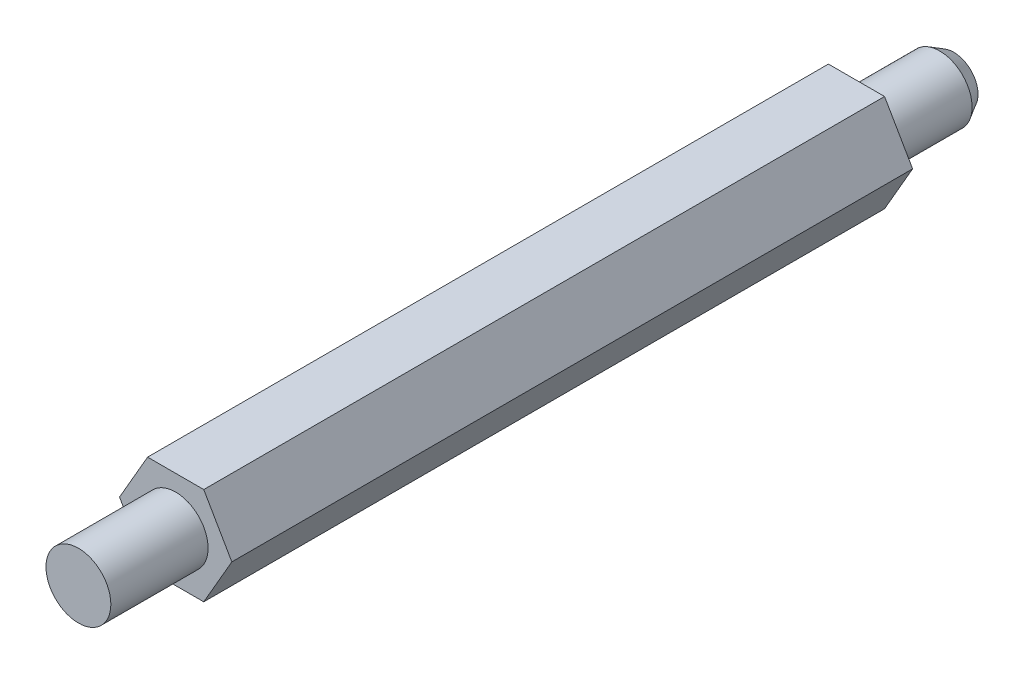
from build123d import *

# Parameters (mm, degrees)
EXTRUDE_1_DEPTH      = 42
EXTRUDE_2_DEPTH      = 6
EXTRUDE_2_DEPTH_BACK = 48
SKETCH_2_R           = 2
CHAMFER_1_SIZE       = 0.5
CHAMFER_1_SIZE2      = 0.866025404


with BuildPart() as part:
    # 草图1 → 拉伸1 (new body)
    with BuildSketch(Plane.XY):
        Polygon((1.732050808, -3), (3.464101615, 0), (1.732050808, 3), (-1.732050808, 3), (-3.464101615, 0), (-1.732050808, -3), align=None)
    extrude(amount=EXTRUDE_1_DEPTH)

    # 草图2 → 拉伸2 (add, two sides: drawn at the far end of the back side and taken through both)
    with BuildSketch(Plane.XY.offset(42).offset(-EXTRUDE_2_DEPTH_BACK)):
        with Locations(Location((0, 0, 0), (0, 0, 180))):
            Circle(SKETCH_2_R)
    extrude(amount=EXTRUDE_2_DEPTH + EXTRUDE_2_DEPTH_BACK)

    # 倒角1
    chamfer_1_edges = [part.edges().sort_by_distance(p)[0] for p in [
        (2, 0, -6),
    ]]
    chamfer_1_side = [part.faces().sort_by_distance(p)[0] for p in [
        (0, 0, -6),
    ]]
    chamfer(chamfer_1_edges, length=CHAMFER_1_SIZE, length2=CHAMFER_1_SIZE2, reference=chamfer_1_side[0])


solid = part.part
